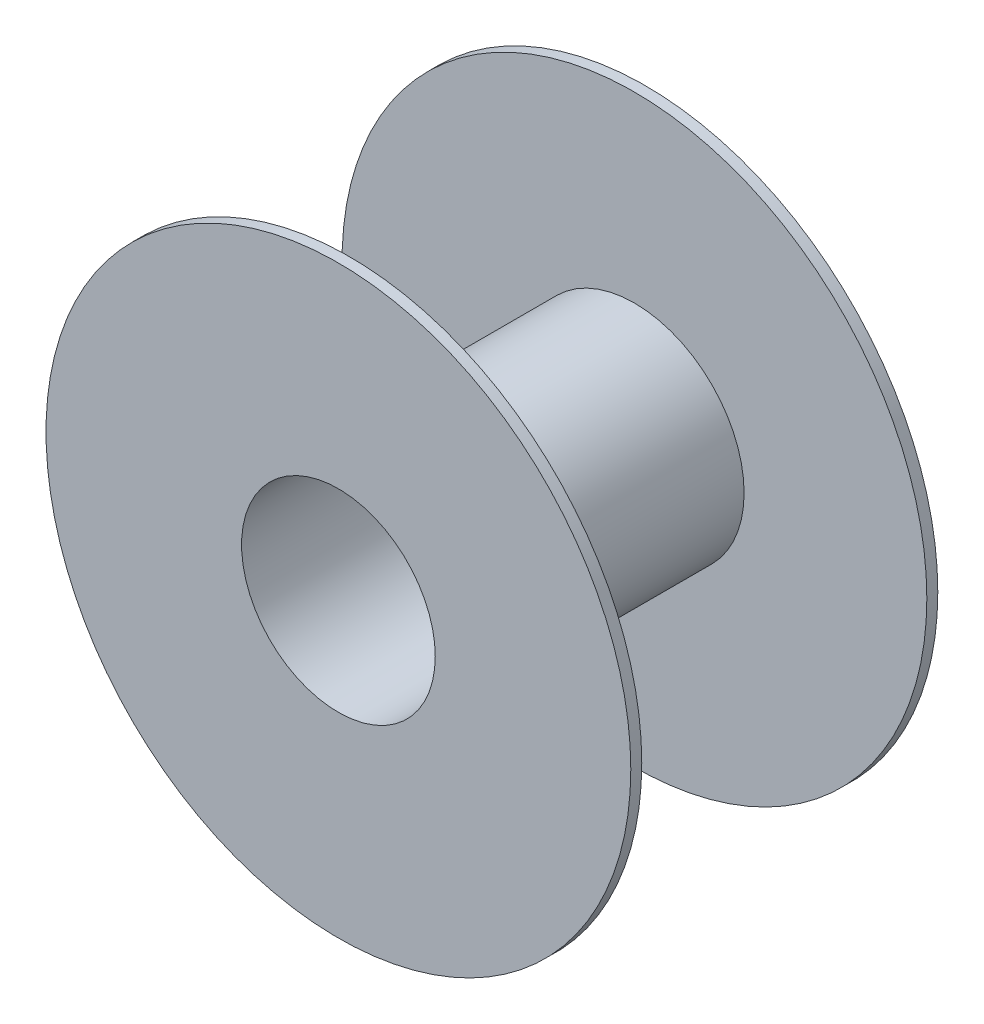
from build123d import *


with BuildPart() as part:
    # Sketch1 → Revolve1 (revolve)
    with BuildSketch(Plane(origin=(0, 0, 0), x_dir=(1, 0, 0), z_dir=(0, 1, 0))):
        Polygon((26.5, 0), (26.5, 84), (80, 84), (80, 81), (30, 81), (30, 3), (80, 3), (80, 0), align=None)
    revolve(axis=Axis((0, 0, 0), (0, 0, -1)))


solid = part.part
